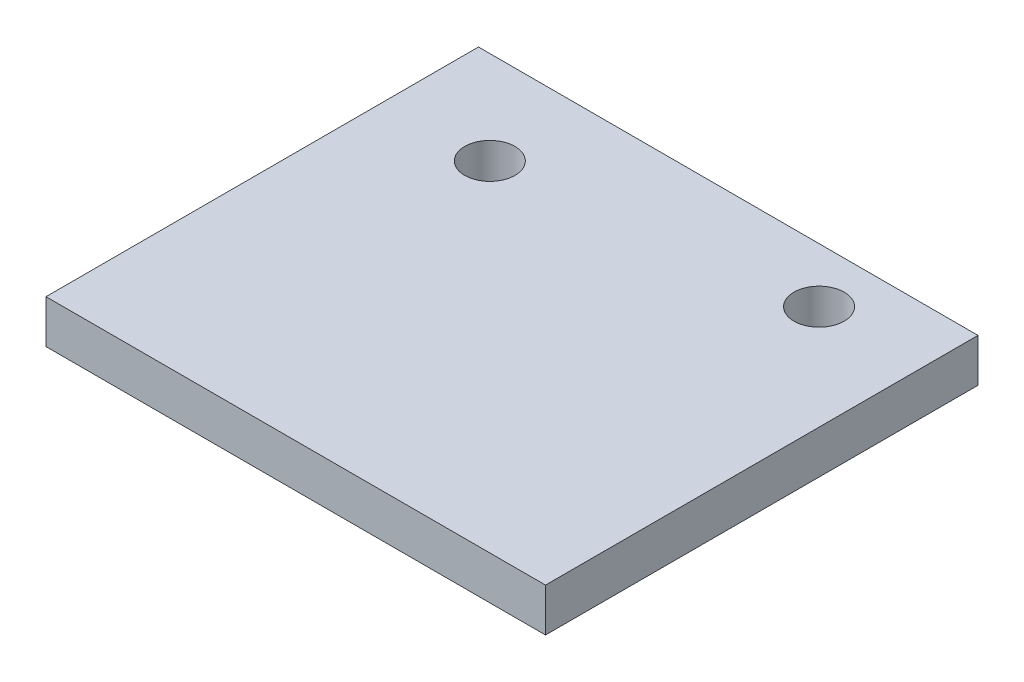
from build123d import *

# Parameters (mm, degrees)
SZKIC1_W                    = 462
SZKIC1_H                    = 400
SZKIC1_R                    = 23.25
DODANIE_WYCI_GNI_CIE1_DEPTH = 40


with BuildPart() as part:
    # Szkic1 → Dodanie-wyciągnięcie1 (new body)
    with BuildSketch(Plane(origin=(0, 0, 0), x_dir=(1, 0, 0), z_dir=(0, 1, 0))):
        with Locations((231, 200)):
            Rectangle(SZKIC1_W, SZKIC1_H)
        with Locations(Location((96.5, 314, 0), (0, 0, 270))):
            Circle(SZKIC1_R, mode=Mode.SUBTRACT)
        with Locations(Location((365.5, 349.5, 0), (0, 0, 270))):
            Circle(SZKIC1_R, mode=Mode.SUBTRACT)
    extrude(amount=DODANIE_WYCI_GNI_CIE1_DEPTH)


solid = part.part
